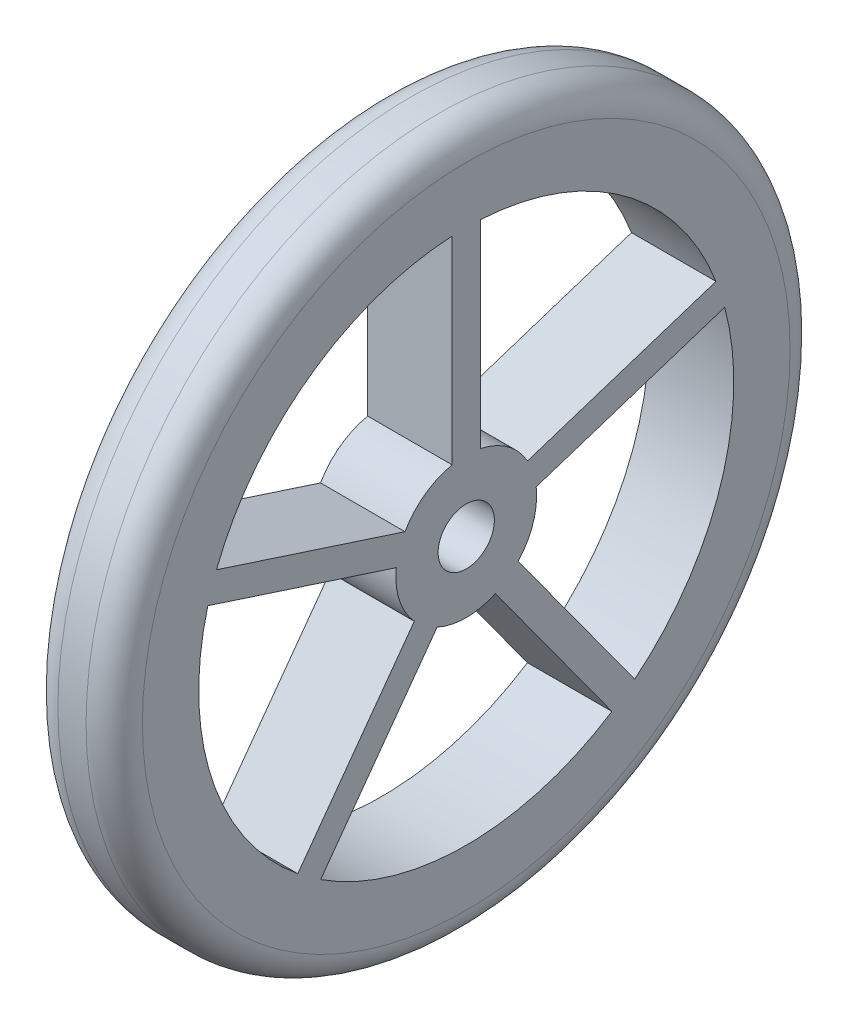
from build123d import *

# Parameters (mm, degrees)
SKETCH1_R           = 250
SKETCH1_R_2         = 20
BOSS_EXTRUDE1_DEPTH = 60
FILLET1_R           = 20


with BuildPart() as part:
    # Sketch1 → Boss-Extrude1 (new body)
    with BuildSketch(Plane(origin=(0, 0, 0), x_dir=(0, 0, -1), z_dir=(1, 0, 0))):
        Circle(SKETCH1_R)
        Circle(SKETCH1_R_2, mode=Mode.SUBTRACT)
        with BuildLine():
            Line((183.540456446, 49.121287113), (49.682233573, 5.628113998))
            ThreePointArc((49.682233573, 5.628113998), (47.552825815, -15.450849719), (36.885648873, -33.755724066))
            Line((36.885648873, -33.755724066), (119.614580282, -147.622329558))
            ThreePointArc((119.614580282, -147.622329558), (180.700738096, -58.713228931), (183.540456446, 49.121287113))
        make_face(mode=Mode.SUBTRACT)
        with BuildLine():
            Line((-10, 189.73665961), (-10, 48.989794856))
            ThreePointArc((-10, 48.989794856), (-29.389262615, 40.450849719), (-43.501893686, 24.649244324))
            Line((-43.501893686, 24.649244324), (-177.360116559, 68.142417438))
            ThreePointArc((-177.360116559, 68.142417438), (-111.679197936, 153.713228931), (-10, 189.73665961))
        make_face(mode=Mode.SUBTRACT)
        with BuildLine():
            Line((10, 189.73665961), (10, 48.989794856))
            ThreePointArc((10, 48.989794856), (29.389262615, 40.450849719), (43.501893686, 24.649244324))
            Line((43.501893686, 24.649244324), (177.360116559, 68.142417438))
            ThreePointArc((177.360116559, 68.142417438), (111.679197936, 153.713228931), (10, 189.73665961))
        make_face(mode=Mode.SUBTRACT)
        with BuildLine():
            Line((103.434240394, -159.378034603), (20.705308985, -45.511429112))
            ThreePointArc((20.705308985, -45.511429112), (0, -50), (-20.705308985, -45.511429112))
            Line((-20.705308985, -45.511429112), (-103.434240394, -159.378034603))
            ThreePointArc((-103.434240394, -159.378034603), (0, -190), (103.434240394, -159.378034603))
        make_face(mode=Mode.SUBTRACT)
        with BuildLine():
            Line((-119.614580282, -147.622329558), (-36.885648873, -33.755724066))
            ThreePointArc((-36.885648873, -33.755724066), (-47.552825815, -15.450849719), (-49.682233573, 5.628113998))
            Line((-49.682233573, 5.628113998), (-183.540456446, 49.121287113))
            ThreePointArc((-183.540456446, 49.121287113), (-180.700738096, -58.713228931), (-119.614580282, -147.622329558))
        make_face(mode=Mode.SUBTRACT)
    extrude(amount=BOSS_EXTRUDE1_DEPTH)

    # Fillet1
    fillet1_edges = [part.edges().sort_by_distance(p)[0] for p in [
        (0, 0, 250),
        (60, 0, 250),
    ]]
    fillet(fillet1_edges, radius=FILLET1_R)


solid = part.part
